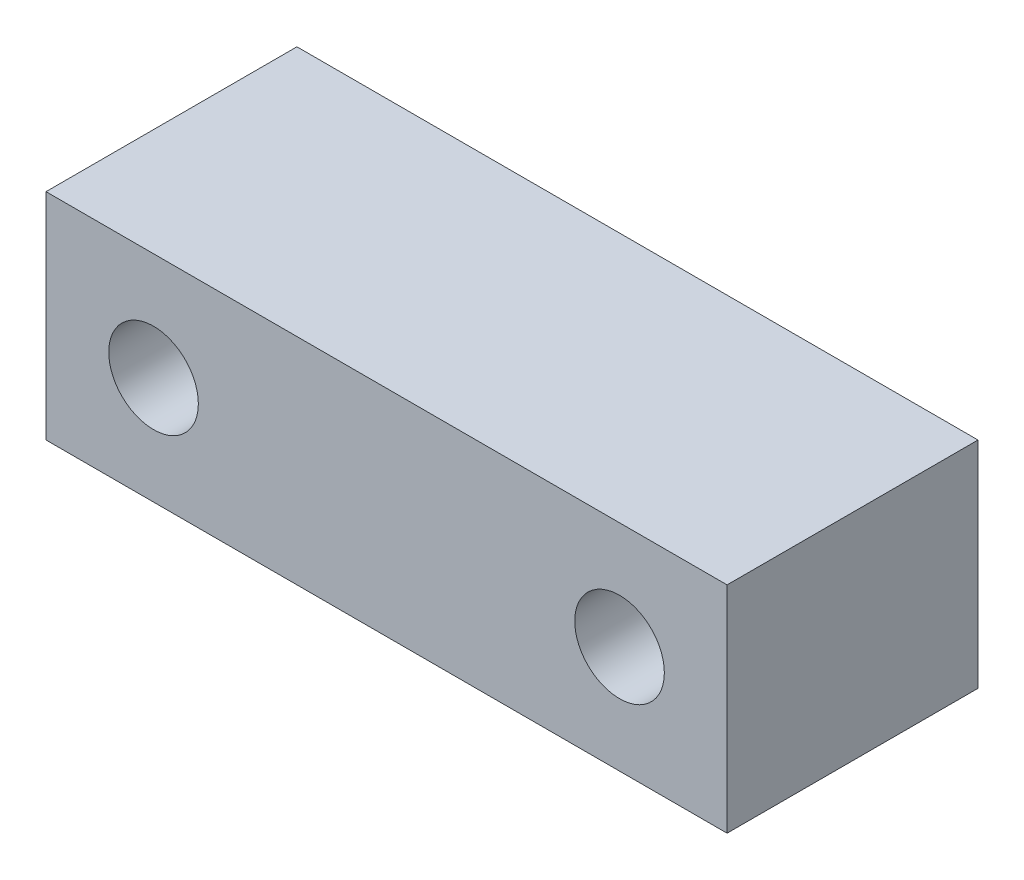
from build123d import *

# Parameters (mm, degrees)
SKETCH1_W           = 6
SKETCH1_H           = 19
SKETCH1_R           = 1.25
BOSS_EXTRUDE1_DEPTH = 7


with BuildPart() as part:
    # Sketch1 → Boss-Extrude1 (new body)
    with BuildSketch(Plane(origin=(0, 0, 0), x_dir=(0, 1, 0), z_dir=(0, 0, 1))):
        Rectangle(SKETCH1_W, SKETCH1_H)
        with Locations(Location((0, 6.5, 0), (0, 0, 270))):
            Circle(SKETCH1_R, mode=Mode.SUBTRACT)
        with Locations(Location((0, -6.5, 0), (0, 0, 270))):
            Circle(SKETCH1_R, mode=Mode.SUBTRACT)
    extrude(amount=BOSS_EXTRUDE1_DEPTH)


solid = part.part
